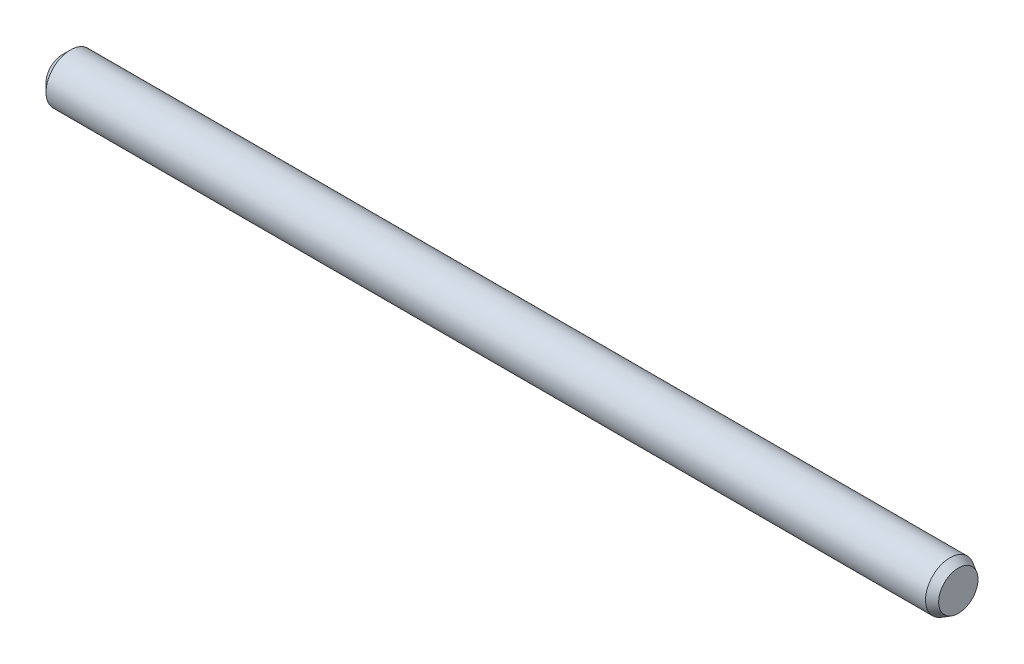
from build123d import *

# Parameters (mm, degrees)
CROQUIS1_R              = 1.475
SALIENTE_EXTRUIR1_DEPTH = 54
CHAFL_N1_SIZE           = 0.5
CHAFL_N1_SIZE2          = 0.288675135
CHAFL_N2_SIZE           = 0.5


with BuildPart() as part:
    # Croquis1 → Saliente-Extruir1 (new body)
    with BuildSketch(Plane(origin=(0, 0, 0), x_dir=(0, 0, -1), z_dir=(1, 0, 0))):
        Circle(CROQUIS1_R)
    extrude(amount=SALIENTE_EXTRUIR1_DEPTH)

    # Chaflán1
    chafl_n1_edges = [part.edges().sort_by_distance(p)[0] for p in [
        (54, 0, 1.475),
    ]]
    chafl_n1_side = [part.faces().sort_by_distance(p)[0] for p in [
        (27, 0, 1.475),
    ]]
    chamfer(chafl_n1_edges, length=CHAFL_N1_SIZE, length2=CHAFL_N1_SIZE2, reference=chafl_n1_side[0])

    # Chaflán2
    chafl_n2_edges = [part.edges().sort_by_distance(p)[0] for p in [
        (0, 0, 1.475),
    ]]
    chamfer(chafl_n2_edges, length=CHAFL_N2_SIZE)


solid = part.part
